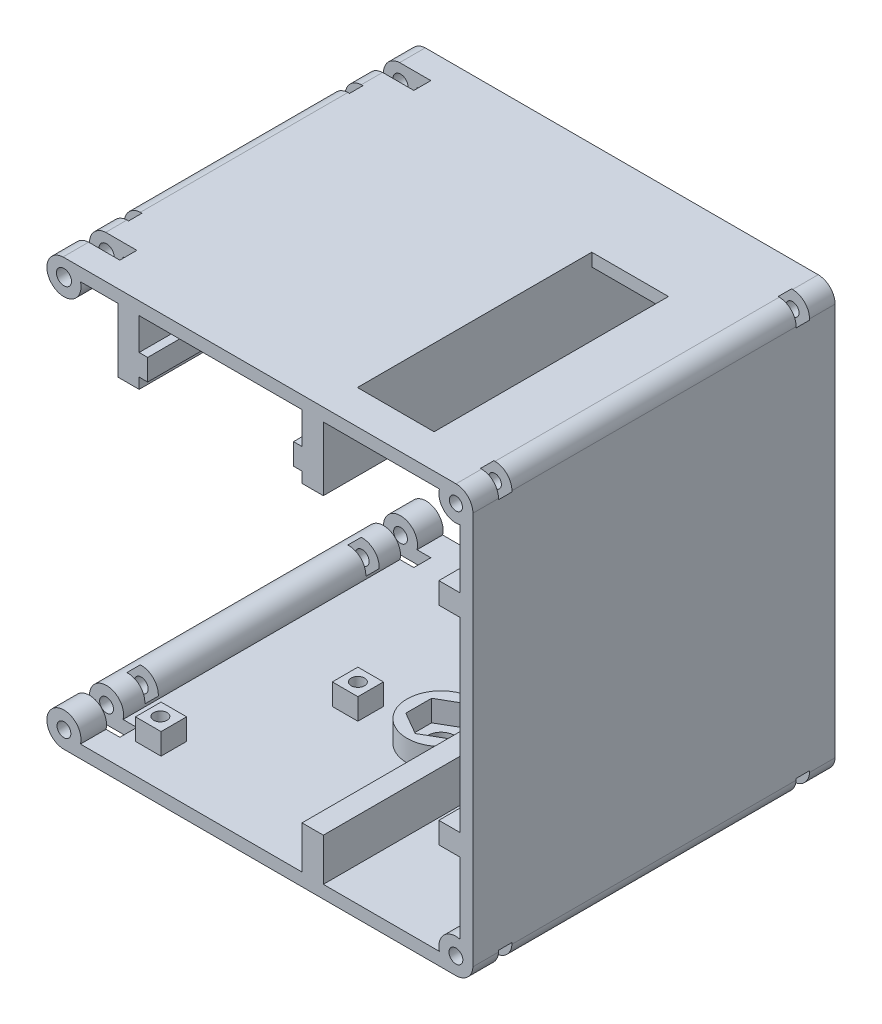
from build123d import *

# Parameters (mm, degrees)
IZIM1_R                     = 1.625
IZIM1_R_2                   = 1.76944457
Y_KSEKLIK_EKSTR_ZYON1_DEPTH = 85
IZIM3_W                     = 6
IZIM3_H                     = 3.15
KES_EKSTR_ZYON2_DEPTH       = 94
IZIM4_W                     = 3.15
IZIM4_H                     = 6
KES_EKSTR_ZYON3_DEPTH       = 91
AYNALAMA3_COPY_1_SKETCH_W   = 6
AYNALAMA3_COPY_1_SKETCH_H   = 3.15
AYNALAMA3_COPY_1_DEPTH      = 94
AYNALAMA3_COPY_2_SKETCH_W   = 3.15
AYNALAMA3_COPY_2_SKETCH_H   = 6
AYNALAMA3_COPY_2_DEPTH      = 91
IZIM5_R                     = 8
Y_KSEKLIK_EKSTR_ZYON2_DEPTH = 5
IZIM6_R                     = 3.173700659
KES_EKSTR_ZYON4_DEPTH       = 6
IZIM7_W                     = 5
IZIM7_H                     = 5
IZIM7_H_2                   = 10
IZIM7_H_3                   = 15
Y_KSEKLIK_EKSTR_ZYON3_DEPTH = 85
IZIM8_W                     = 18
IZIM8_H                     = 55
KES_EKSTR_ZYON5_DEPTH       = 3
IZIM9_W                     = 2
IZIM9_H                     = 5
Y_KSEKLIK_EKSTR_ZYON4_DEPTH = 85
IZIM10_W                    = 6
IZIM10_H                    = 6
Y_KSEKLIK_EKSTR_ZYON5_DEPTH = 5
IZIM12_R                    = 1.575
KES_EKSTR_ZYON6_DEPTH       = 5
IZIM13_W                    = 3
IZIM13_H                    = 84.254033307
KES_EKSTR_ZYON7_DEPTH       = 119.2234811
IZIM14_W                    = 4
IZIM14_H                    = 10
IZIM14_H_2                  = 9.621574808
KES_EKSTR_ZYON8_DEPTH       = 11.121097644
IZIM15_W                    = 11.121097644
IZIM15_H                    = 4
KES_EKSTR_ZYON9_DEPTH       = 142.269705154
KES_EKSTR_ZYON10_DEPTH      = 119.2234811
KES_EKSTR_ZYON12_DEPTH      = 119.2234811
KES_EKSTR_ZYON13_START      = -55
IZIM18_W                    = 3.15
IZIM18_H                    = 6
KES_EKSTR_ZYON13_DEPTH      = 30
KES_EKSTR_ZYON14_START      = -55
IZIM20_W                    = 6
IZIM20_H                    = 3.15
KES_EKSTR_ZYON14_DEPTH      = 30


with BuildPart() as part:
    # Çizim1 → Yükseklik-Ekstrüzyon1 (new body)
    with BuildSketch(Plane.XY):
        with BuildLine():
            Line((47.715327128, -32.802859347), (47.715327128, 59.397828294))
            ThreePointArc((47.715327128, 59.397828294), (47.683738911, 59.899216036), (47.589473794, 60.39267482))
            ThreePointArc((47.589473794, 60.39267482), (46.545272031, 62.222650992), (44.715327128, 63.266907554))
            ThreePointArc((44.715327128, 63.266907554), (44.236900739, 63.359256703), (43.750790253, 63.39267482))
            Line((43.750790253, 63.39267482), (43.689939231, 63.39267482))
            Line((43.689939231, 63.39267482), (-48.482616147, 63.39267482))
            ThreePointArc((-48.482616147, 63.39267482), (-51.178938929, 62.153556551), (-52.279635258, 59.397828294))
            Line((-52.279635258, 59.397828294), (-52.279635258, -32.602171706))
            ThreePointArc((-52.279635258, -32.602171706), (-50.984025193, -35.549420436), (-47.936497718, -36.587426607))
            Line((-47.936497718, -36.587426607), (43.754368381, -36.602027172))
            ThreePointArc((43.754368381, -36.602027172), (46.489220254, -35.488941379), (47.715327128, -32.802859347))
        make_face()
        with Locations((-48.279635258, -32.602171706)):
            Circle(IZIM1_R, mode=Mode.SUBTRACT)
        with Locations((43.720364742, -32.602171706)):
            Circle(IZIM1_R, mode=Mode.SUBTRACT)
        with Locations((-48.279635258, 59.397828294)):
            Circle(IZIM1_R_2, mode=Mode.SUBTRACT)
        with BuildLine():
            ThreePointArc((-49.279635258, 55.524844948), (-45.45309022, 56.567520335), (-44.405324947, 60.39267482))
            Line((-44.405324947, 60.39267482), (39.851255689, 60.39267482))
            ThreePointArc((39.851255689, 60.39267482), (40.895542044, 56.572921005), (44.715327128, 55.528749035))
            Line((44.715327128, 55.528749035), (44.715327128, -28.727891147))
            ThreePointArc((44.715327128, -28.727891147), (40.890378845, -29.775304212), (39.847183505, -33.601404966))
            Line((39.847183505, -33.601404966), (-44.403017685, -33.587989229))
            ThreePointArc((-44.403017685, -33.587989229), (-45.456389141, -29.768573046), (-49.279635258, -28.729188359))
            Line((-49.279635258, -28.729188359), (-49.279635258, 55.524844948))
        make_face(mode=Mode.SUBTRACT)
        with BuildLine():
            ThreePointArc((45.251730856, 59.397828294), (42.329549538, 58.756957601), (44.715327128, 60.561929676))
            ThreePointArc((44.715327128, 60.561929676), (44.803257989, 60.480613773), (44.88456514, 60.39267482))
            ThreePointArc((44.88456514, 60.39267482), (45.157010004, 59.928047653), (45.251730856, 59.397828294))
        make_face(mode=Mode.SUBTRACT)
    extrude(amount=Y_KSEKLIK_EKSTR_ZYON1_DEPTH)

    # Çizim3 → Kes-Ekstrüzyon2 (cut)
    with BuildSketch(Plane(origin=(5.556519781, 5.556519781, 0), x_dir=(0.7071067811865477, -0.7071067811865475, 0), z_dir=(0.7071067811865475, 0.7071067811865477, 0))):
        with Locations((-11.074842784, -7.575)):
            Rectangle(IZIM3_W, IZIM3_H)
    kes_ekstr_zyon2 = extrude(amount=KES_EKSTR_ZYON2_DEPTH, mode=Mode.SUBTRACT)

    # Aynalama1: Kes-Ekstrüzyon2 across plane
    add(kes_ekstr_zyon2.mirror(Plane.ZY.offset(2.282154065)), mode=Mode.SUBTRACT)

    # Çizim4 → Kes-Ekstrüzyon3 (cut)
    with BuildSketch(Plane(origin=(-7.842287929, 7.84353681, 0), x_dir=(0, 0, 1), z_dir=(0.70705048021597, -0.7071630776747089, 0))):
        with Locations((7.575, -7.805616524)):
            Rectangle(IZIM4_W, IZIM4_H)
    kes_ekstr_zyon3 = extrude(amount=KES_EKSTR_ZYON3_DEPTH, mode=Mode.SUBTRACT)

    # Aynalama2: Kes-Ekstrüzyon3 across plane
    add(kes_ekstr_zyon3.mirror(Plane.ZY.offset(2.282154065)), mode=Mode.SUBTRACT)

    # Aynalama3: Kes-Ekstrüzyon2, Kes-Ekstrüzyon3 across plane
    add(kes_ekstr_zyon2.mirror(Plane(origin=(0, 0, 42.5), x_dir=(1, 0, 0), z_dir=(0, 0, -1))), mode=Mode.SUBTRACT)
    add(kes_ekstr_zyon3.mirror(Plane(origin=(0, 0, 42.5), x_dir=(1, 0, 0), z_dir=(0, 0, -1))), mode=Mode.SUBTRACT)

    # Aynalama3 copy 1 sketch → Aynalama3 copy 1 (cut)
    with BuildSketch(Plane(origin=(-10.120827911, 5.556519781, 85), x_dir=(-0.7071067811865477, -0.7071067811865475, 0), z_dir=(-0.7071067811865475, 0.7071067811865477, 0))):
        with Locations((-11.074842784, -7.575)):
            Rectangle(AYNALAMA3_COPY_1_SKETCH_W, AYNALAMA3_COPY_1_SKETCH_H)
    extrude(amount=AYNALAMA3_COPY_1_DEPTH, mode=Mode.SUBTRACT)

    # Aynalama3 copy 2 sketch → Aynalama3 copy 2 (cut)
    with BuildSketch(Plane(origin=(3.277979799, 7.84353681, 85), x_dir=(0, 0, -1), z_dir=(-0.70705048021597, -0.7071630776747089, 0))):
        with Locations((7.575, -7.805616524)):
            Rectangle(AYNALAMA3_COPY_2_SKETCH_W, AYNALAMA3_COPY_2_SKETCH_H)
    extrude(amount=AYNALAMA3_COPY_2_DEPTH, mode=Mode.SUBTRACT)

    # Çizim5 → Yükseklik-Ekstrüzyon2 (add)
    with BuildSketch(Plane(origin=(-0.005349572, -33.595058974, 0), x_dir=(0.9999999873218124, -0.00015923685273262365, 0), z_dir=(0.00015923685273262363, 0.9999999873218123, 0))):
        with Locations(Location((-2.256805007, -42.5, 0), (0, 0, 180))):
            Circle(IZIM5_R)
        Polygon((-2.256805007, -36.437822174), (-7.506805007, -39.468911087), (-7.506805007, -45.531088913), (-2.256805007, -48.562177826), (2.993194993, -45.531088913), (2.993194993, -39.468911087), align=None, mode=Mode.SUBTRACT)
    extrude(amount=Y_KSEKLIK_EKSTR_ZYON2_DEPTH)

    # Çizim6 → Kes-Ekstrüzyon4 (cut)
    with BuildSketch(Plane(origin=(-0.005827282, -36.595058936, 0), x_dir=(0.9999999873218124, -0.00015923685273257598, 0), z_dir=(-0.00015923685273257595, -0.9999999873218123, 0))):
        with Locations((-2.256805007, 42.5)):
            Circle(IZIM6_R)
    extrude(amount=-KES_EKSTR_ZYON4_DEPTH, mode=Mode.SUBTRACT)

    # Çizim7 → Yükseklik-Ekstrüzyon3 (add)
    with BuildSketch(Plane.XY.offset(85)):
        with Locations((42.215327128, 39.203556093)):
            Rectangle(IZIM7_W, IZIM7_H)
        with Locations((42.215327128, -9.521228717)):
            Rectangle(IZIM7_W, IZIM7_H)
        with Locations((10.103517379, -28.59706677)):
            Rectangle(IZIM7_W, IZIM7_H_2)
        with Locations((10.103517379, 52.89267482)):
            Rectangle(IZIM7_W, IZIM7_H_3)
    extrude(amount=-Y_KSEKLIK_EKSTR_ZYON3_DEPTH)

    # Çizim8 → Kes-Ekstrüzyon5 (cut)
    with BuildSketch(Plane(origin=(0, 63.39267482, 0), x_dir=(1, 0, 0), z_dir=(0, 1, 0))):
        with Locations((21.603517379, -49.5)):
            Rectangle(IZIM8_W, IZIM8_H)
    extrude(amount=-KES_EKSTR_ZYON5_DEPTH, mode=Mode.SUBTRACT)

    # Çizim9 → Yükseklik-Ekstrüzyon4 (add)
    with BuildSketch(Plane.XY.offset(85)):
        with Locations((-29.630502869, 50.39267482)):
            Rectangle(IZIM9_W, IZIM9_H)
        Polygon((-30.630502869, 52.89267482), (-30.630502869, 60.39267482), (-35.630502869, 60.39267482), (-35.630502869, 45.39267482), (-30.630502869, 45.39267482), (-30.630502869, 47.89267482), align=None)
        with Locations((6.603517379, 50.39267482)):
            Rectangle(IZIM9_W, IZIM9_H)
    extrude(amount=-Y_KSEKLIK_EKSTR_ZYON4_DEPTH)

    # Çizim10 → Yükseklik-Ekstrüzyon5 (add)
    with BuildSketch(Plane(origin=(-0.005349572, -33.595058974, 0), x_dir=(0.9999999873218124, -0.0001592368527326237, 0), z_dir=(0.00015923685273262368, 0.9999999873218123, 0))):
        with Locations((-19.48504195, -44.8)):
            Rectangle(IZIM10_W, IZIM10_H)
        with Locations((-35.48504195, -75)):
            Rectangle(IZIM10_W, IZIM10_H)
    extrude(amount=Y_KSEKLIK_EKSTR_ZYON5_DEPTH)

    # Çizim12 → Kes-Ekstrüzyon6 (cut)
    with BuildSketch(Plane(origin=(-0.004553387, -28.595059038, 0), x_dir=(0.9999999873218124, -0.00015923685273260457, 0), z_dir=(0.00015923685273260454, 0.9999999873218123, 0))):
        with Locations(Location((-35.640119157, -75, 0), (0, 0, 180))):
            Circle(IZIM12_R)
        with Locations(Location((-19.48504195, -44.8, 0), (0, 0, 180))):
            Circle(IZIM12_R)
    extrude(amount=-KES_EKSTR_ZYON6_DEPTH, mode=Mode.SUBTRACT)

    # Çizim13 → Kes-Ekstrüzyon7 (cut, through all)
    with BuildSketch(Plane.XY.offset(85)):
        with Locations((-50.779635258, 13.397828295)):
            Rectangle(IZIM13_W, IZIM13_H)
    extrude(amount=-KES_EKSTR_ZYON7_DEPTH, mode=Mode.SUBTRACT)

    # Çizim14 → Kes-Ekstrüzyon8 (cut)
    with BuildSketch(Plane.ZY.offset(52.279635258)):
        with Locations((8, 58.39267482)):
            Rectangle(IZIM14_W, IZIM14_H)
        with Locations((77, 58.581887416)):
            Rectangle(IZIM14_W, IZIM14_H_2)
    extrude(amount=-KES_EKSTR_ZYON8_DEPTH, mode=Mode.SUBTRACT)

    # Çizim15 → Kes-Ekstrüzyon9 (cut, through all)
    with BuildSketch(Plane(origin=(0, 63.39267482, 0), x_dir=(1, 0, 0), z_dir=(0, 1, 0))):
        with Locations((-46.719086436, -8)):
            Rectangle(IZIM15_W, IZIM15_H)
        with Locations((-46.719086436, -77)):
            Rectangle(IZIM15_W, IZIM15_H)
    extrude(amount=-KES_EKSTR_ZYON9_DEPTH, mode=Mode.SUBTRACT)

    # Çizim16 → Kes-Ekstrüzyon10 (cut, through all)
    with BuildSketch(Plane.XY.offset(85)):
        with BuildLine():
            Line((-52.279635258, -28.729188359), (-52.279635258, -32.602171706))
            ThreePointArc((-52.279635258, -32.602171706), (-51.441912919, -30.152681963), (-49.279635258, -28.729188359))
            Line((-49.279635258, -28.729188359), (-52.279635258, -28.729188359))
        make_face()
    extrude(amount=-KES_EKSTR_ZYON10_DEPTH, mode=Mode.SUBTRACT)

    # Çizim19 → Kes-Ekstrüzyon12 (cut, through all)
    with BuildSketch(Plane.XY.offset(85)):
        with BuildLine():
            ThreePointArc((-49.279635258, 55.524844948), (-51.441912919, 56.948338552), (-52.279635258, 59.397828294))
            Line((-52.279635258, 59.397828294), (-52.279635258, 55.524844948))
            Line((-52.279635258, 55.524844948), (-49.279635258, 55.524844948))
        make_face()
    extrude(amount=-KES_EKSTR_ZYON12_DEPTH, mode=Mode.SUBTRACT)

    # Çizim18 → Kes-Ekstrüzyon13 (cut)
    with BuildSketch(Plane(origin=(-7.842287929, 7.84353681, 0), x_dir=(0, 0, 1), z_dir=(0.70705048021597, -0.7071630776747089, 0)).offset(KES_EKSTR_ZYON13_START)):
        with Locations((16.575, -7.805616524)):
            Rectangle(IZIM18_W, IZIM18_H)
        with Locations((68.425, -7.805616524)):
            Rectangle(IZIM18_W, IZIM18_H)
    extrude(amount=-KES_EKSTR_ZYON13_DEPTH, mode=Mode.SUBTRACT)

    # Çizim20 → Kes-Ekstrüzyon14 (cut)
    with BuildSketch(Plane(origin=(5.556519781, 5.556519781, 0), x_dir=(0.7071067811865477, -0.7071067811865475, 0), z_dir=(0.7071067811865475, 0.7071067811865477, 0)).offset(KES_EKSTR_ZYON14_START)):
        with Locations((-11.074842784, -16.575)):
            Rectangle(IZIM20_W, IZIM20_H)
        with Locations((-11.074842784, -68.425)):
            Rectangle(IZIM20_W, IZIM20_H)
    extrude(amount=-KES_EKSTR_ZYON14_DEPTH, mode=Mode.SUBTRACT)


solid = part.part
